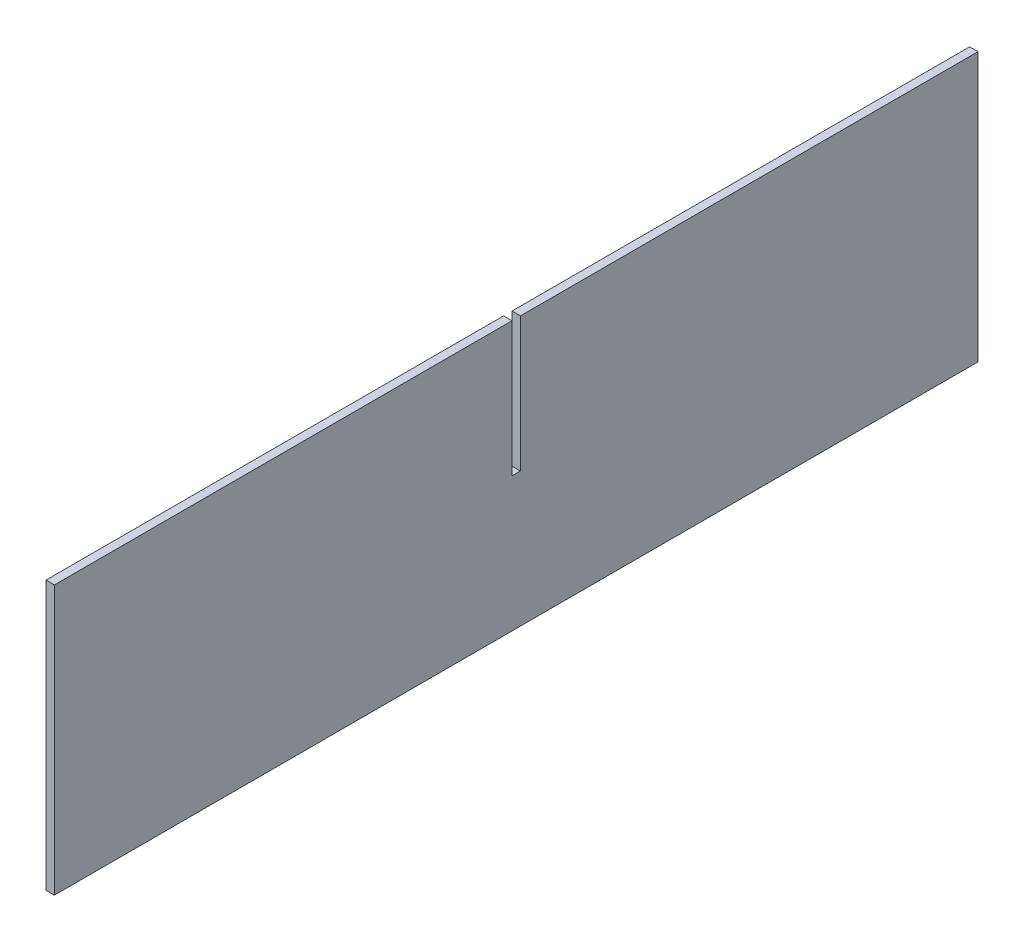
from build123d import *

# Parameters (mm, degrees)
BOSS_EXTRUDE1_DEPTH = 1.25


with BuildPart() as part:
    # Sketch1 → Boss-Extrude1 (new, symmetric)
    with BuildSketch(Plane(origin=(0, 0, 0), x_dir=(0, 0, -1), z_dir=(1, 0, 0))):
        Polygon((-137.5, -40), (137.5, -40), (137.5, 40), (1.25, 40), (1.25, 0), (-1.25, 0), (-1.25, 40), (-137.5, 40), align=None)
    extrude(amount=BOSS_EXTRUDE1_DEPTH, both=True)


solid = part.part
